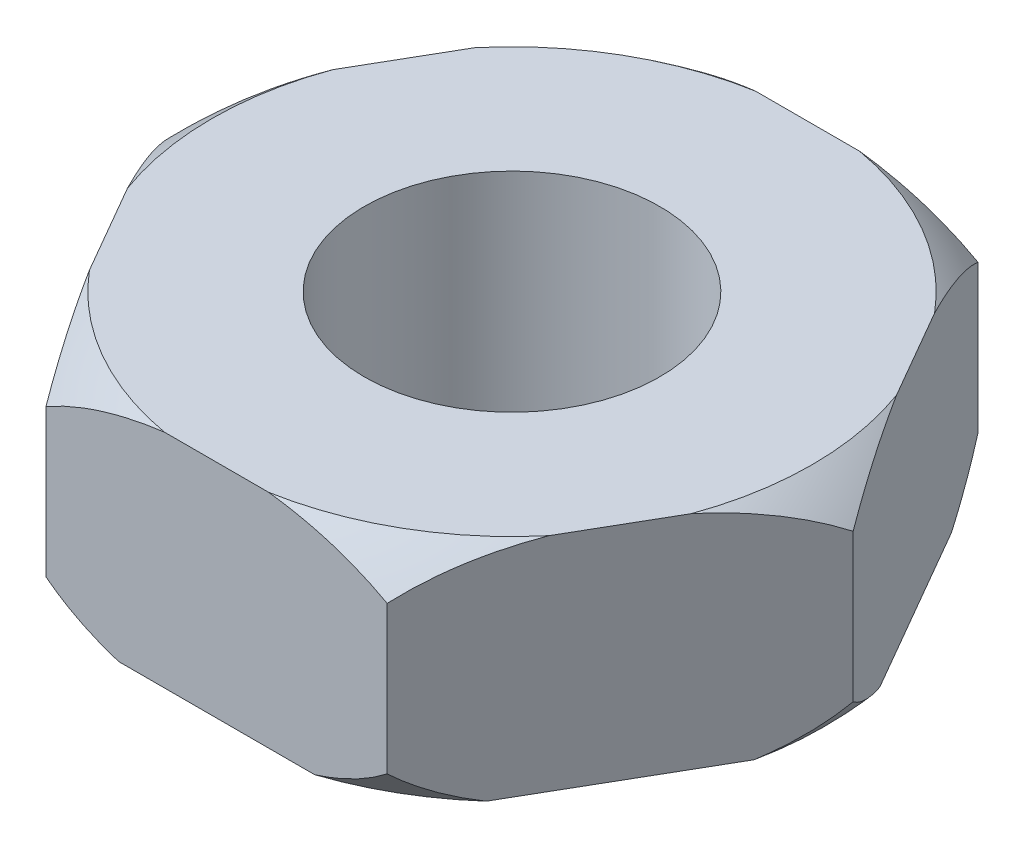
from build123d import *

# Parameters (mm, degrees)
SKIZZE1_R                       = 2
AUFSATZ_LINEAR_AUSTRAGEN1_DEPTH = 1.5


with BuildPart() as part:
    # Skizze1 → Aufsatz-Linear austragen1 (new, symmetric)
    with BuildSketch(Plane(origin=(0, 0, 0), x_dir=(1, 0, 0), z_dir=(0, 1, 0))):
        Polygon((-2.309401077, 4), (-4.618802154, 0), (-2.309401077, -4), (2.309401077, -4), (4.618802154, 0), (2.309401077, 4), align=None)
        Circle(SKIZZE1_R, mode=Mode.SUBTRACT)
    extrude(amount=AUFSATZ_LINEAR_AUSTRAGEN1_DEPTH, both=True)

    # Skizze2 → Schnitt-Rotation1 (revolve, cut)
    with BuildSketch(Plane.XY):
        with BuildLine():
            Line((0, 1.5), (0, 2.733189598))
            Line((0, 2.733189598), (4.618802154, 2.733189598))
            Line((4.618802154, 2.733189598), (4.618802154, 1))
            ThreePointArc((4.618802154, 1), (2.405106227, 2.134086305), (0, 1.5))
        make_face()
        with BuildLine():
            Line((4.618802154, -1), (4.618802154, -2.751278334))
            Line((4.618802154, -2.751278334), (0, -2.751278334))
            Line((0, -2.751278334), (0, -1.5))
            ThreePointArc((0, -1.5), (2.428755218, -2.352546333), (4.618802154, -1))
        make_face()
    revolve(axis=Axis((0, 1.5, 0), (0, -1, 0)), mode=Mode.SUBTRACT)


solid = part.part
